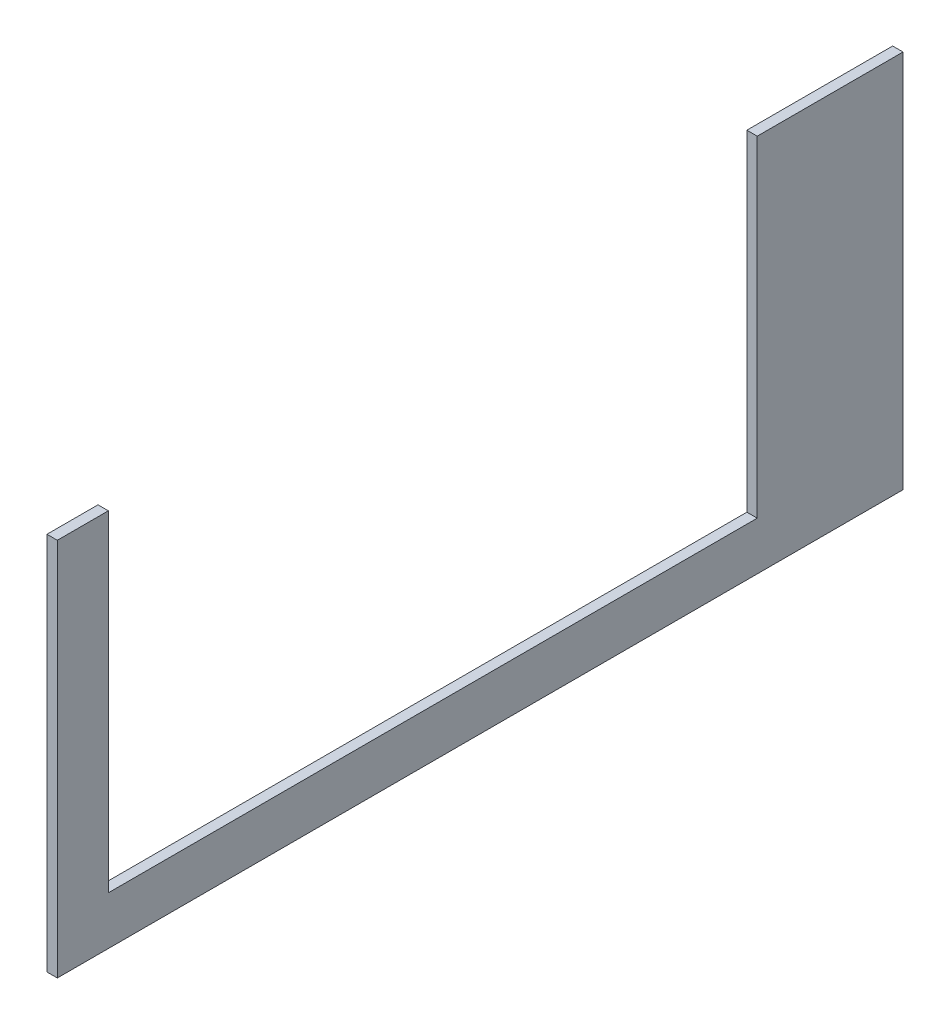
from build123d import *

# Parameters (mm, degrees)
BOSS_EXTRUDE1_DEPTH = 3.556


with BuildPart() as part:
    # Sketch1 → Boss-Extrude1 (new, symmetric)
    with BuildSketch(Plane(origin=(0, 0, 0), x_dir=(0, 0, 1), z_dir=(1, 0, 0))):
        Polygon((-480, -260), (-580, -260), (-580, 0), (0, 0), (0, -260), (-35, -260), (-35, -33.112), (-480, -33.112), align=None)
    extrude(amount=BOSS_EXTRUDE1_DEPTH, both=True)


solid = part.part
